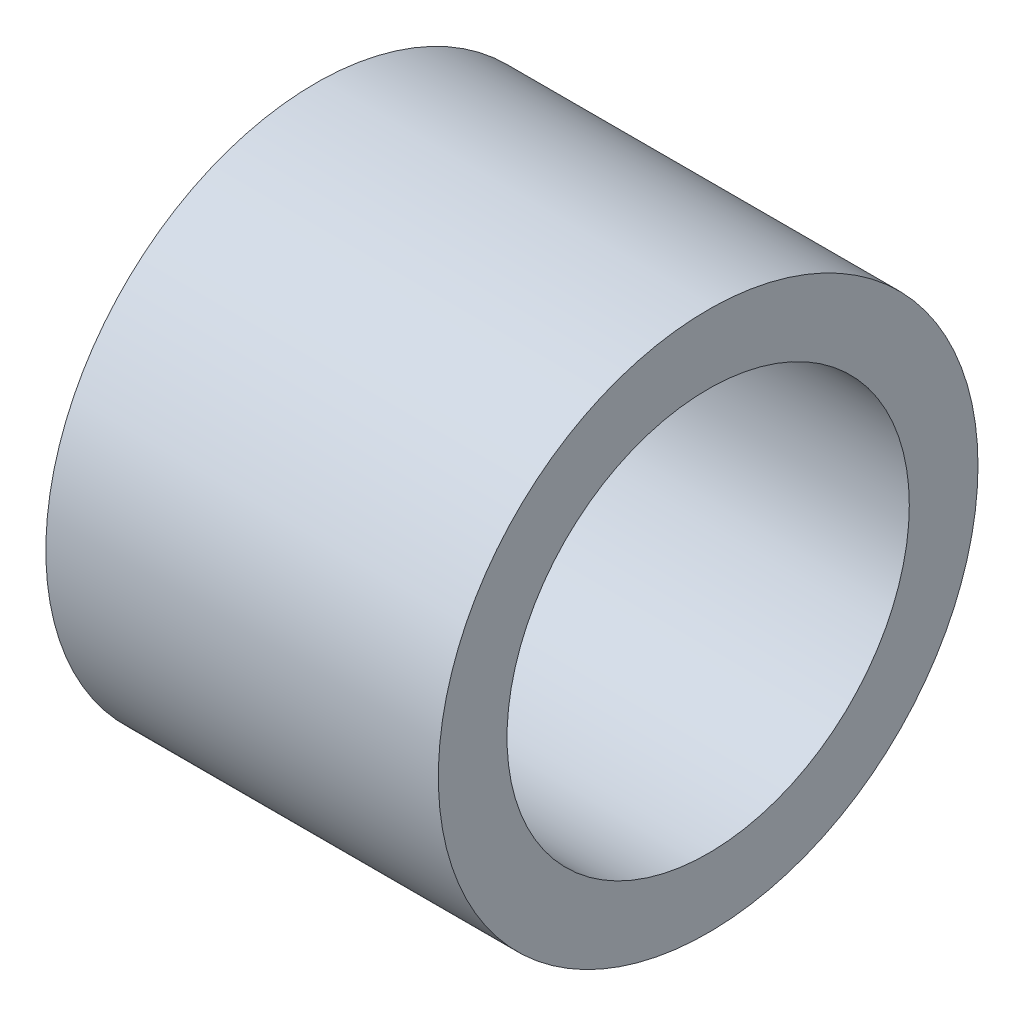
from build123d import *

# Parameters (mm, degrees)
SKETCH1_R           = 5.5
SKETCH1_R_2         = 4.1
BOSS_EXTRUDE1_DEPTH = 8


with BuildPart() as part:
    # Sketch1 → Boss-Extrude1 (new body)
    with BuildSketch(Plane(origin=(0, 0, 0), x_dir=(0, 0, -1), z_dir=(1, 0, 0))):
        Circle(SKETCH1_R)
        Circle(SKETCH1_R_2, mode=Mode.SUBTRACT)
    extrude(amount=BOSS_EXTRUDE1_DEPTH)


solid = part.part
